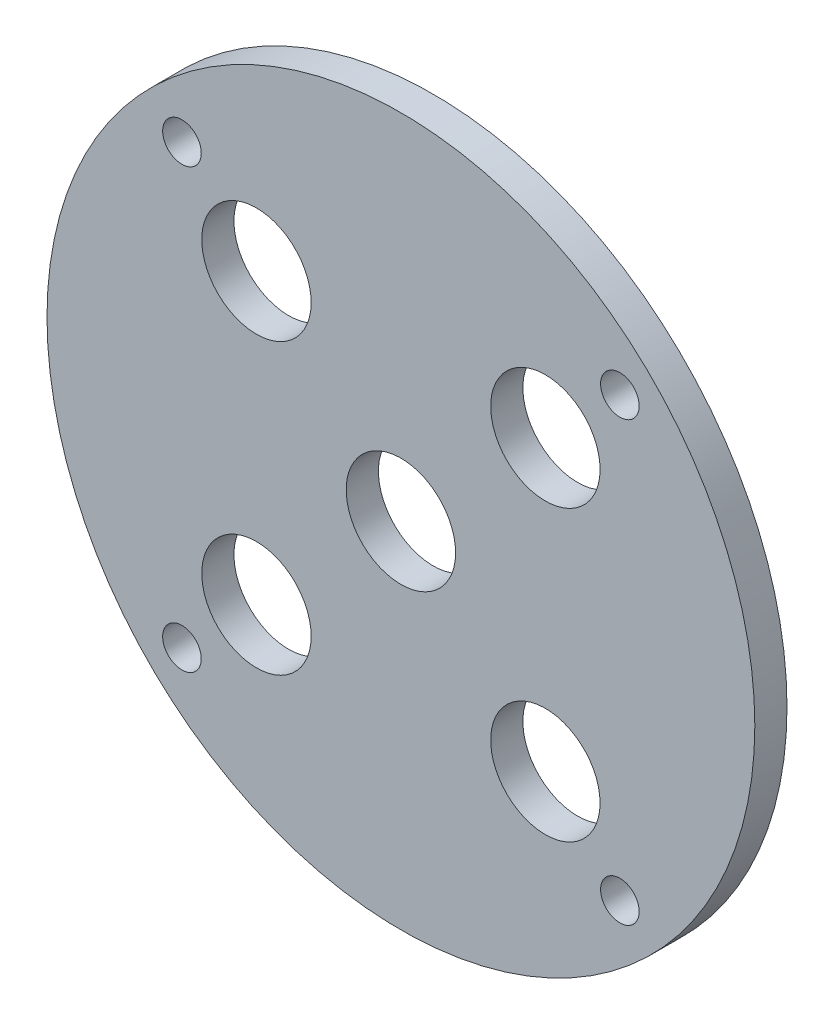
from build123d import *

# Parameters (mm, degrees)
SKETCH2_R           = 11
SKETCH2_R_2         = 1.7
SKETCH2_R_3         = 0.6
BOSS_EXTRUDE1_DEPTH = 1


with BuildPart() as part:
    # Sketch2 → Boss-Extrude1 (new body)
    with BuildSketch(Plane.XY):
        with Locations((0, -8.8655e-05)):
            Circle(SKETCH2_R)
        with Locations((-4.490128061, 4.490039406)):
            Circle(SKETCH2_R_2, mode=Mode.SUBTRACT)
        with Locations((4.490128061, 4.490039406)):
            Circle(SKETCH2_R_2, mode=Mode.SUBTRACT)
        with Locations((-4.490128061, -4.490216715)):
            Circle(SKETCH2_R_2, mode=Mode.SUBTRACT)
        with Locations((4.490128061, -4.490216715)):
            Circle(SKETCH2_R_2, mode=Mode.SUBTRACT)
        with Locations((0, -8.8655e-05)):
            Circle(SKETCH2_R_2, mode=Mode.SUBTRACT)
        with Locations((6.80553822, 6.805449565)):
            Circle(SKETCH2_R_3, mode=Mode.SUBTRACT)
        with Locations((6.805449565, -6.80553822)):
            Circle(SKETCH2_R_3, mode=Mode.SUBTRACT)
        with Locations((-6.80553822, -6.805449565)):
            Circle(SKETCH2_R_3, mode=Mode.SUBTRACT)
        with Locations((-6.805449565, 6.80553822)):
            Circle(SKETCH2_R_3, mode=Mode.SUBTRACT)
    extrude(amount=BOSS_EXTRUDE1_DEPTH)


solid = part.part
